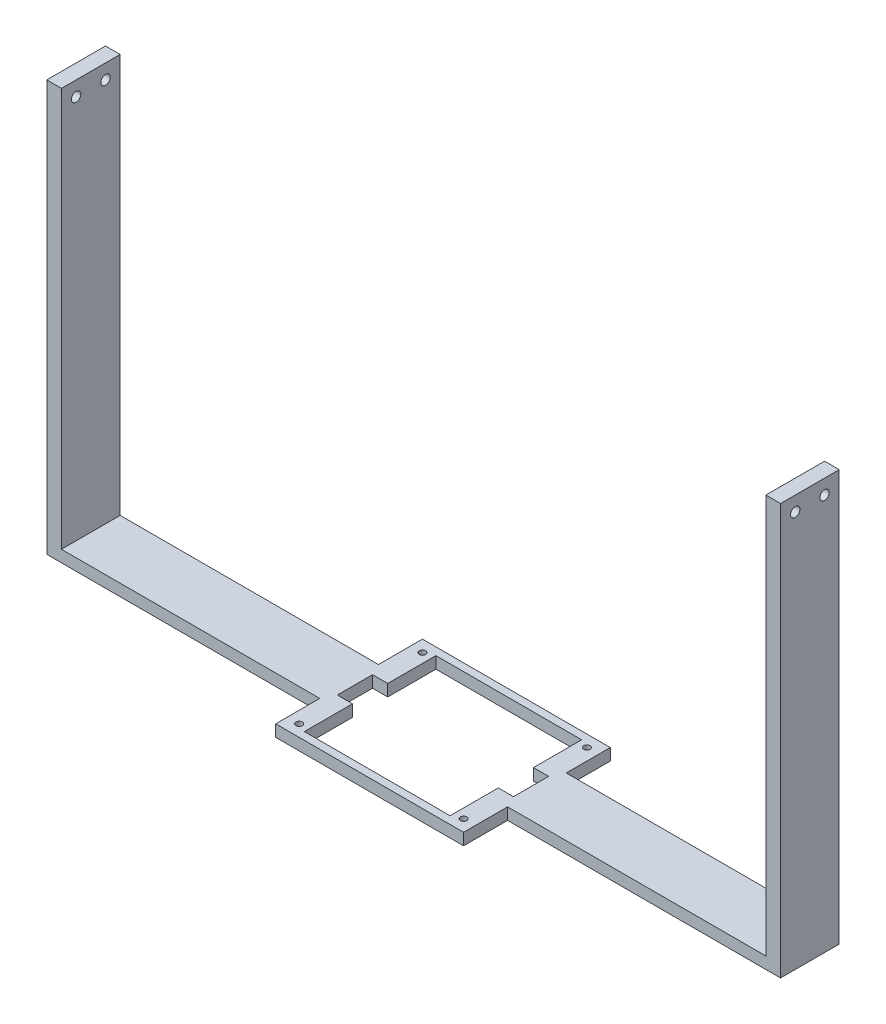
from build123d import *

# Parameters (mm, degrees)
SKETCH_1_W          = 250
SKETCH_1_H          = 20
SKETCH_1_W_2        = 60
SKETCH_1_H_2        = 12
EXTRUDE_1_DEPTH     = 4
SKETCH_2_W          = 20
SKETCH_2_H          = 140
SKETCH_2_R          = 1.6
EXTRUDE_2_DEPTH     = 5
SKETCH_3_W          = 64
SKETCH_3_H          = 15
SKETCH_3_R          = 1.1
EXTRUDE_3_DEPTH     = 4
SKETCH_4_W          = 49.65332139
SKETCH_4_H          = 44.815301216
CUT_EXTRUDE_1_DEPTH = 4


with BuildPart() as part:
    # 草图1 → 凸台-拉伸1 (new body)
    with BuildSketch(Plane(origin=(0, 0, 0), x_dir=(1, 0, 0), z_dir=(0, 1, 0))):
        Rectangle(SKETCH_1_W, SKETCH_1_H)
        Rectangle(SKETCH_1_W_2, SKETCH_1_H_2, mode=Mode.SUBTRACT)
    extrude(amount=EXTRUDE_1_DEPTH)

    # 草图2 → 凸台-拉伸2 (add)
    with BuildSketch(Plane.ZY.offset(125)):
        with Locations((0, 70)):
            Rectangle(SKETCH_2_W, SKETCH_2_H)
        with Locations((-5, 135)):
            Circle(SKETCH_2_R, mode=Mode.SUBTRACT)
        with Locations(Location((5, 135, 0), (0, 0, 180))):
            Circle(SKETCH_2_R, mode=Mode.SUBTRACT)
    extrude_2 = extrude(amount=-EXTRUDE_2_DEPTH)

    # 镜向1: 凸台-拉伸2 across plane
    add(extrude_2.mirror(Plane(origin=(0, 0, 0), x_dir=(0, 0, 1), z_dir=(1, 0, 0))))

    # 草图3 → 凸台-拉伸3 (add)
    # profile 1 of 2: a face of its own
    with BuildSketch(Plane(origin=(0, 4, 0), x_dir=(1, 0, 0), z_dir=(0, 1, 0))):
        with Locations((0, 17.5)):
            Rectangle(SKETCH_3_W, SKETCH_3_H)
        with Locations(Location((-28, 21, 0), (0, 0, 270))):
            Circle(SKETCH_3_R, mode=Mode.SUBTRACT)
        with Locations(Location((28, 21, 0), (0, 0, 270))):
            Circle(SKETCH_3_R, mode=Mode.SUBTRACT)
    # profile 2 of 2: a face of its own
    with BuildSketch(Plane(origin=(0, 4, 0), x_dir=(1, 0, 0), z_dir=(0, 1, 0))):
        with Locations((0, -17.5)):
            Rectangle(SKETCH_3_W, SKETCH_3_H)
        with Locations(Location((-28, -21, 0), (0, 0, 270))):
            Circle(SKETCH_3_R, mode=Mode.SUBTRACT)
        with Locations(Location((28, -21, 0), (0, 0, 270))):
            Circle(SKETCH_3_R, mode=Mode.SUBTRACT)
    extrude(amount=-EXTRUDE_3_DEPTH)

    # 草图4 → 切除-拉伸1 (cut)
    with BuildSketch(Plane(origin=(0, 4, 0), x_dir=(1, 0, 0), z_dir=(0, 1, 0))):
        Rectangle(SKETCH_4_W, SKETCH_4_H)
    extrude(amount=-CUT_EXTRUDE_1_DEPTH, mode=Mode.SUBTRACT)


solid = part.part
